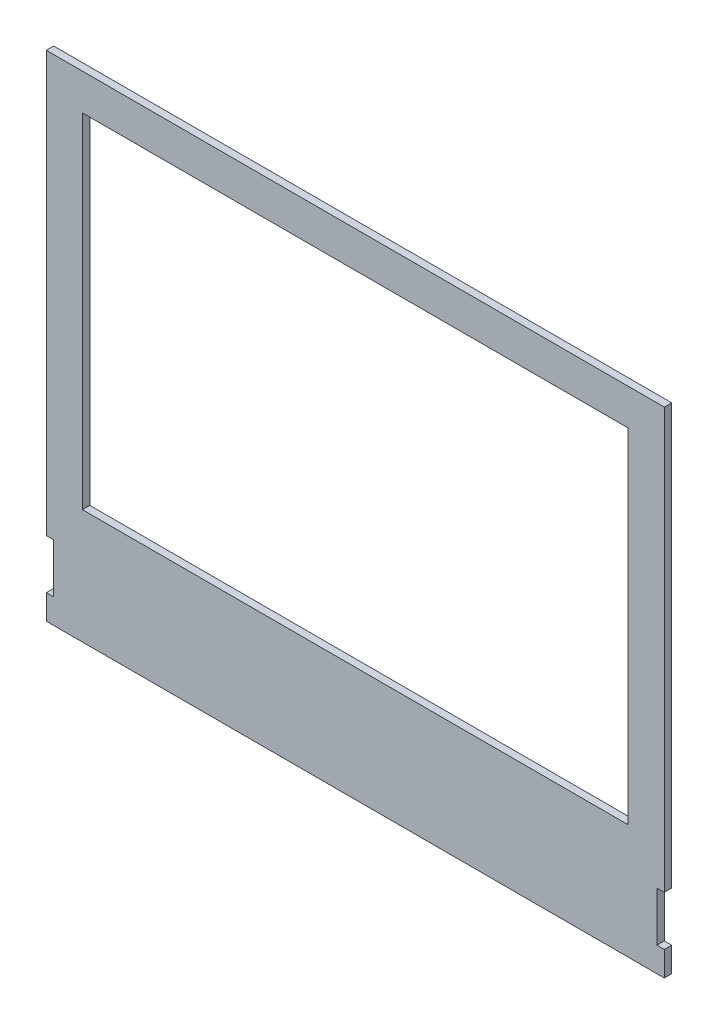
from build123d import *

# Parameters (mm, degrees)
SKETCH1_W           = 250
SKETCH1_H           = 200
BOSS_EXTRUDE1_DEPTH = 3
SKETCH2_W           = 220.76
SKETCH2_H           = 139
CUT_EXTRUDE1_DEPTH  = 321.170267202
SKETCH5_W           = 3
SKETCH5_H           = 20
CUT_EXTRUDE3_DEPTH  = 10


with BuildPart() as part:
    # Sketch1 → Boss-Extrude1 (new body)
    with BuildSketch(Plane.XY):
        with Locations((125, 100)):
            Rectangle(SKETCH1_W, SKETCH1_H)
    extrude(amount=BOSS_EXTRUDE1_DEPTH)

    # Sketch2 → Cut-Extrude1 (cut, through all)
    with BuildSketch(Plane.XY.offset(3)):
        with Locations((125, 115.88)):
            Rectangle(SKETCH2_W, SKETCH2_H)
    extrude(amount=-CUT_EXTRUDE1_DEPTH, mode=Mode.SUBTRACT)

    # Sketch5 → Cut-Extrude3 (cut)
    with BuildSketch(Plane.XY.offset(3)):
        with Locations((1.5, 20)):
            Rectangle(SKETCH5_W, SKETCH5_H)
        with Locations((248.5, 20)):
            Rectangle(SKETCH5_W, SKETCH5_H)
    extrude(amount=-CUT_EXTRUDE3_DEPTH, mode=Mode.SUBTRACT)


solid = part.part
